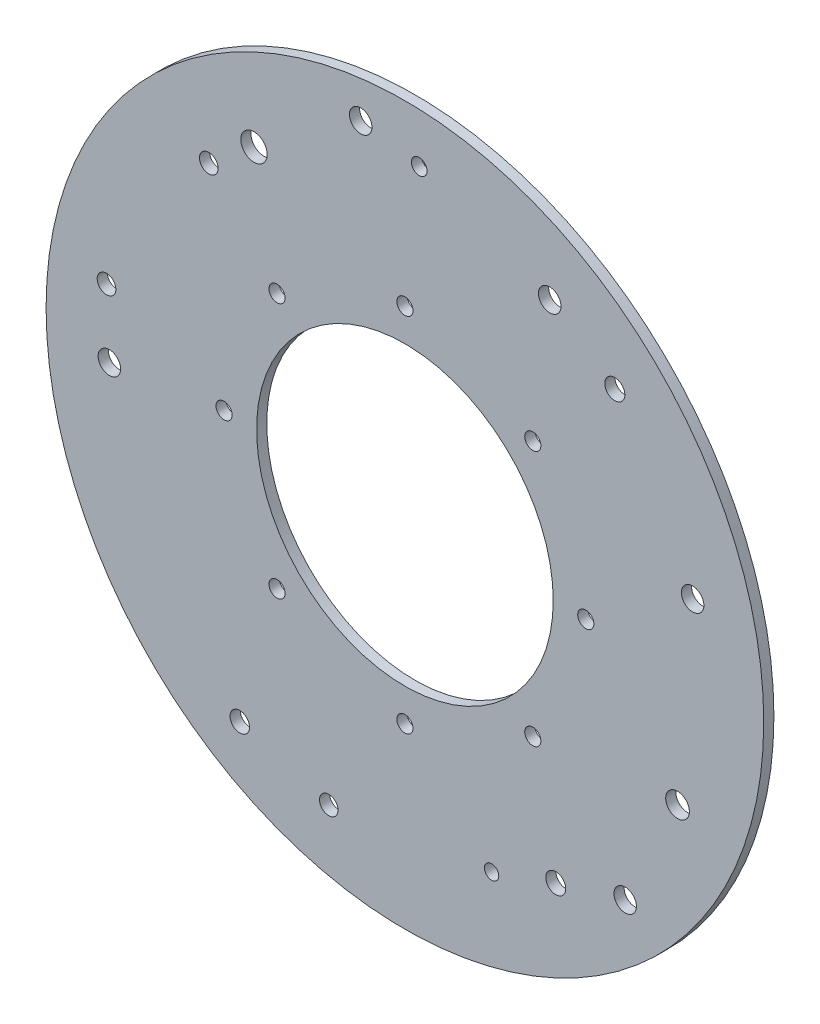
from build123d import *

# Parameters (mm, degrees)
SKETCH1_R                    = 211.670411635
SKETCH1_R_2                  = 6.985
SKETCH1_R_3                  = 6.6294
SKETCH1_R_4                  = 5.8928
SKETCH1_R_5                  = 4.2291
SKETCH1_R_6                  = 5.461
SKETCH1_R_7                  = 5.7531
SKETCH1_R_8                  = 5.4991
SKETCH1_R_9                  = 7.7978
SKETCH1_R_10                 = 6.6421
SKETCH1_R_11                 = 4.6228
SKETCH1_R_12                 = 5.9182
BOSS_EXTRUDE1_DEPTH          = 6
SKETCH2_R                    = 87.5
CUT_EXTRUDE1_DEPTH           = 300.4072917
F_3_8_0_375_DIAMETER_HOLE1_D = 9.525
CIRPATTERN1_COUNT            = 4


with BuildPart() as part:
    # Sketch1 → Boss-Extrude1 (new body)
    with BuildSketch(Plane.XY):
        Circle(SKETCH1_R)
        with Locations((160.80232, -67.72402)):
            Circle(SKETCH1_R_2, mode=Mode.SUBTRACT)
        with Locations((129.93116, -131.74726)):
            Circle(SKETCH1_R_3, mode=Mode.SUBTRACT)
        with Locations((88.98382, -143.60906)):
            Circle(SKETCH1_R_4, mode=Mode.SUBTRACT)
        with Locations((51.13274, -156.81706)):
            Circle(SKETCH1_R_5, mode=Mode.SUBTRACT)
        with Locations((-44.93006, -170.61434)):
            Circle(SKETCH1_R_6, mode=Mode.SUBTRACT)
        with Locations((-97.40392, -154.3431)):
            Circle(SKETCH1_R_7, mode=Mode.SUBTRACT)
        with Locations((-174.33036, -9.32688)):
            Circle(SKETCH1_R_3, mode=Mode.SUBTRACT)
        with Locations((-176.0118908, 29.95676)):
            Circle(SKETCH1_R_8, mode=Mode.SUBTRACT)
        with Locations((-89.03716, 143.4338)):
            Circle(SKETCH1_R_9, mode=Mode.SUBTRACT)
        with Locations((-26.09596, 188.2775)):
            Circle(SKETCH1_R_10, mode=Mode.SUBTRACT)
        with Locations((8.42772, 182.19674)):
            Circle(SKETCH1_R_11, mode=Mode.SUBTRACT)
        with Locations((85.42274, 152.58034)):
            Circle(SKETCH1_R_10, mode=Mode.SUBTRACT)
        with Locations((123.8123, 126.18466)):
            Circle(SKETCH1_R_12, mode=Mode.SUBTRACT)
        with Locations((169.7101, 41.9354)):
            Circle(SKETCH1_R_10, mode=Mode.SUBTRACT)
        with Locations((-115.69192, 121.86666)):
            Circle(SKETCH1_R_8, mode=Mode.SUBTRACT)
    extrude(amount=BOSS_EXTRUDE1_DEPTH)

    # Sketch2 → Cut-Extrude1 (cut, through all)
    with BuildSketch(Plane.XY.offset(6)):
        Circle(SKETCH2_R)
    extrude(amount=-CUT_EXTRUDE1_DEPTH, mode=Mode.SUBTRACT)

    # 3/8 (0.375) Diameter Hole1 (through all)
    with Locations(Plane(origin=(0, 106.68, 6), x_dir=(1, 0, 0), z_dir=(0, 0, 1))):
        with Locations((0, 0), (75.434151417, -31.245848583)):
            f_3_8_0_375_diameter_hole1 = Hole(F_3_8_0_375_DIAMETER_HOLE1_D / 2)

    # CirPattern1: 3/8 (0.375) Diameter Hole1 ×4 about axis
    cirpattern1_axis = Axis((0, 0, 0), (0, 0, 1))
    for i in range(1, CIRPATTERN1_COUNT):
        add(f_3_8_0_375_diameter_hole1.rotate(cirpattern1_axis, i * 360 / CIRPATTERN1_COUNT), mode=Mode.SUBTRACT)


solid = part.part
